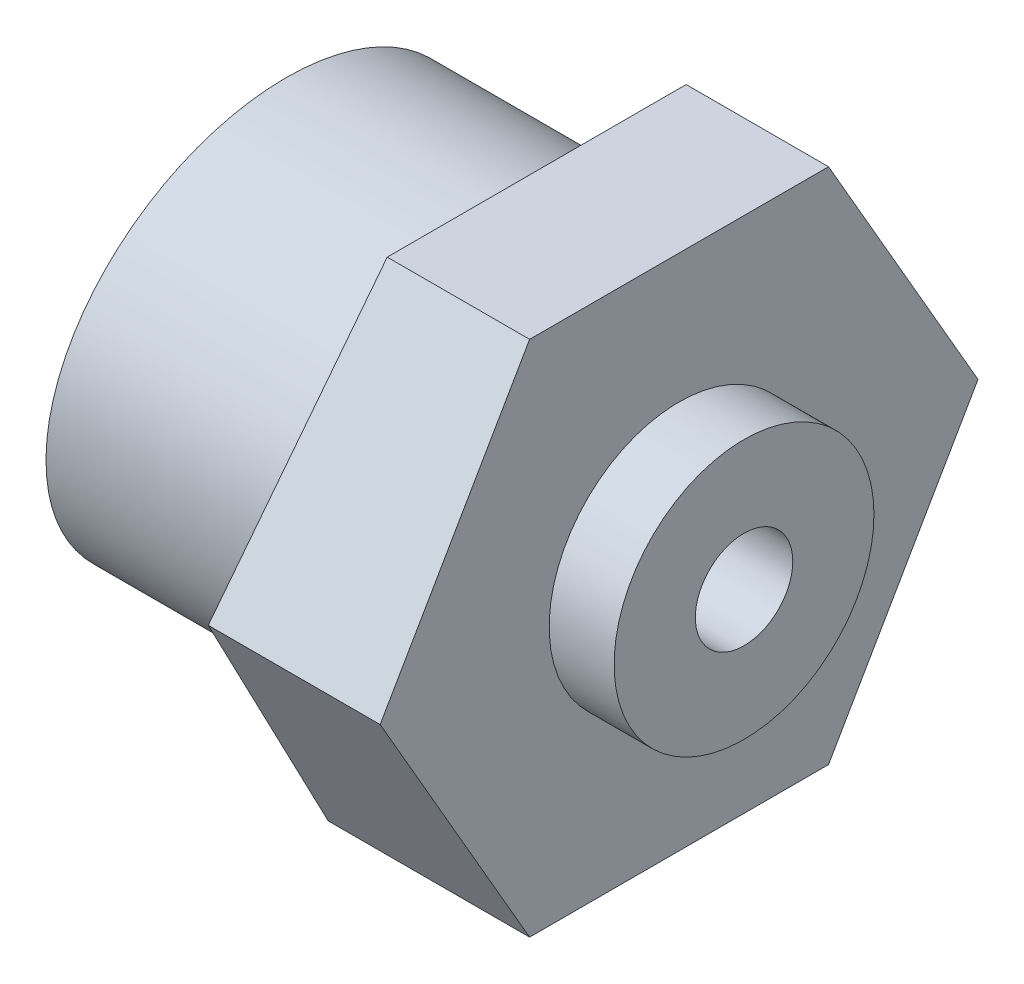
from build123d import *

# Parameters (mm, degrees)
SALIENTE_EXTRUIR1_DEPTH = 3.1
CORTAR_EXTRUIR1_DEPTH   = 16.5
CROQUIS3_R              = 3.3
SALIENTE_EXTRUIR2_DEPTH = 6.8
CORTAR_EXTRUIR2_DEPTH   = 3.4
CROQUIS5_R              = 2
SALIENTE_EXTRUIR3_DEPTH = 1
CROQUIS6_R              = 0.75
CORTAR_EXTRUIR3_DEPTH   = 10.894132521


with BuildPart() as part:
    # Croquis1 → Saliente-Extruir1 (new body)
    with BuildSketch(Plane(origin=(0, 0, 0), x_dir=(0, 0, -1), z_dir=(1, 0, 0))):
        Polygon((-4.601481645, 0), (-2.300740823, -3.985), (2.300740823, -3.985), (4.601481645, 0), (2.300740823, 3.985), (-2.300740823, 3.985), align=None)
    extrude(amount=-SALIENTE_EXTRUIR1_DEPTH)

    # Croquis2 → Cortar-Extruir1 (cut, symmetric)
    with BuildSketch(Plane.XY):
        Polygon((-3.1, -3.985), (-2.191933202, 3.985), (-3.527931865, 3.985), align=None)
    extrude(amount=CORTAR_EXTRUIR1_DEPTH, both=True, mode=Mode.SUBTRACT)

    # Croquis3 → Saliente-Extruir2 (add)
    with BuildSketch(Plane(origin=(0, 0, 0), x_dir=(0, 0, -1), z_dir=(1, 0, 0))):
        Circle(CROQUIS3_R)
    extrude(amount=-SALIENTE_EXTRUIR2_DEPTH)

    # Croquis4 → Cortar-Extruir2 (cut, symmetric)
    with BuildSketch(Plane.XY):
        Polygon((-6.8, -3.3), (-6.048024985, 3.3), (-6.8, 3.3), align=None)
    extrude(amount=CORTAR_EXTRUIR2_DEPTH, both=True, mode=Mode.SUBTRACT)

    # Croquis5 → Saliente-Extruir3 (add)
    with BuildSketch(Plane(origin=(0, 0, 0), x_dir=(0, 0, -1), z_dir=(1, 0, 0))):
        Circle(CROQUIS5_R)
    extrude(amount=SALIENTE_EXTRUIR3_DEPTH)

    # Croquis6 → Cortar-Extruir3 (cut, through all)
    with BuildSketch(Plane(origin=(1, 0, 0), x_dir=(0, 0, -1), z_dir=(1, 0, 0))):
        Circle(CROQUIS6_R)
    extrude(amount=-CORTAR_EXTRUIR3_DEPTH, mode=Mode.SUBTRACT)


solid = part.part
